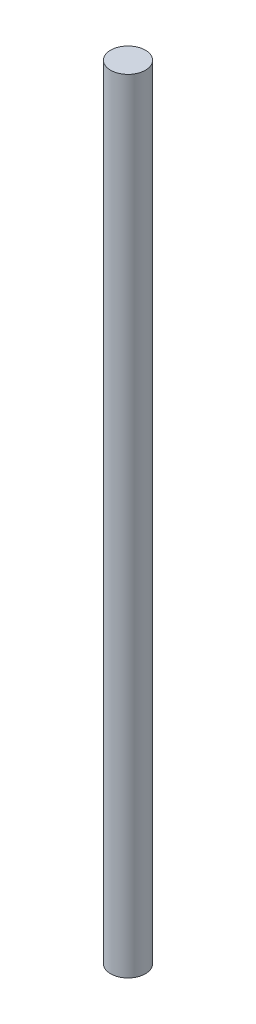
from build123d import *

# Parameters (mm, degrees)
SKETCH1_R           = 2
BOSS_EXTRUDE1_DEPTH = 45


with BuildPart() as part:
    # Sketch1 → Boss-Extrude1 (new, symmetric)
    with BuildSketch(Plane(origin=(0, 0, 0), x_dir=(1, 0, 0), z_dir=(0, 1, 0))):
        with Locations(Location((0, 0, 0), (0, 0, 90))):
            Circle(SKETCH1_R)
    extrude(amount=BOSS_EXTRUDE1_DEPTH, both=True)


solid = part.part
